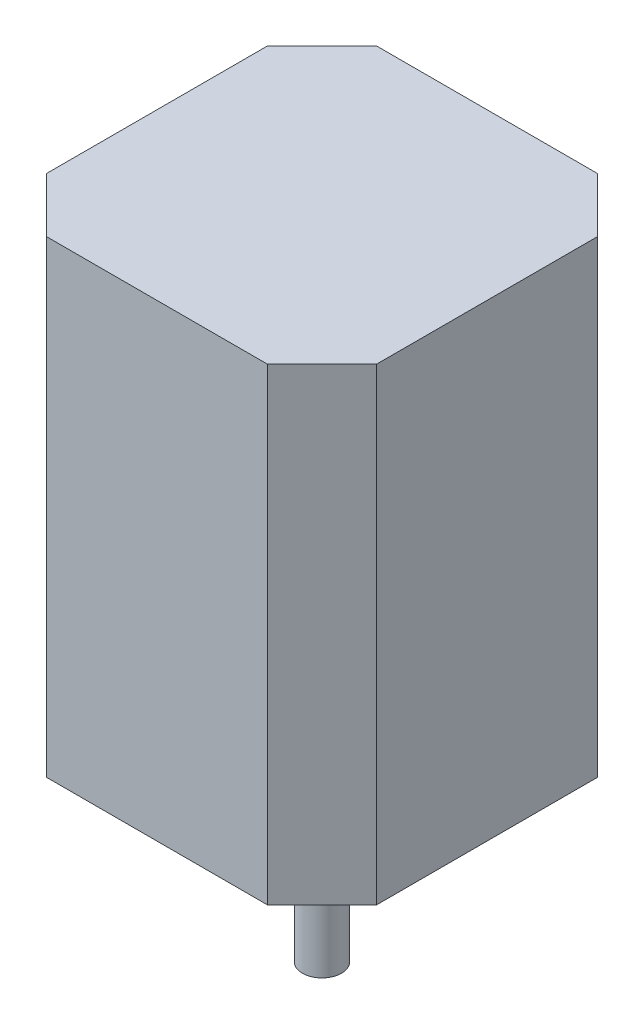
from build123d import *

# Parameters (mm, degrees)
EXTRUDE_1_DEPTH     = 60
SKETCH_2_R          = 11
EXTRUDE_2_DEPTH     = 2
SKETCH_4_R          = 1.5
CUT_EXTRUDE_1_DEPTH = 4.5
SKETCH_3_R          = 2.5
EXTRUDE_3_DEPTH     = 22


with BuildPart() as part:
    # 草图1 → 凸台-拉伸1 (new body)
    with BuildSketch(Plane(origin=(0, 0, 0), x_dir=(1, 0, 0), z_dir=(0, 1, 0))):
        Polygon((14.15, -21.15), (21.15, -14.15), (21.15, 14.15), (14.15, 21.15), (-14.15, 21.15), (-21.15, 14.15), (-21.15, -14.15), (-14.15, -21.15), align=None)
    extrude(amount=EXTRUDE_1_DEPTH)

    # 草图2 → 凸台-拉伸2 (add)
    with BuildSketch(Plane.XZ):
        with Locations(Location((0, 0, 0), (0, 0, 270))):
            Circle(SKETCH_2_R)
    extrude(amount=EXTRUDE_2_DEPTH)

    # 草图4 → 切除-拉伸1 (cut)
    with BuildSketch(Plane.XZ):
        with Locations(Location((15.5, 15.5, 0), (0, 0, 270))):
            Circle(SKETCH_4_R)
        with Locations(Location((15.5, -15.5, 0), (0, 0, 270))):
            Circle(SKETCH_4_R)
        with Locations(Location((-15.5, -15.5, 0), (0, 0, 270))):
            Circle(SKETCH_4_R)
        with Locations(Location((-15.5, 15.5, 0), (0, 0, 270))):
            Circle(SKETCH_4_R)
    extrude(amount=-CUT_EXTRUDE_1_DEPTH, mode=Mode.SUBTRACT)

    # 草图3 → 凸台-拉伸3 (add)
    with BuildSketch(Plane.XZ.offset(2)):
        with Locations(Location((0, 0, 0), (0, 0, 270))):
            Circle(SKETCH_3_R)
    extrude(amount=EXTRUDE_3_DEPTH)


solid = part.part
